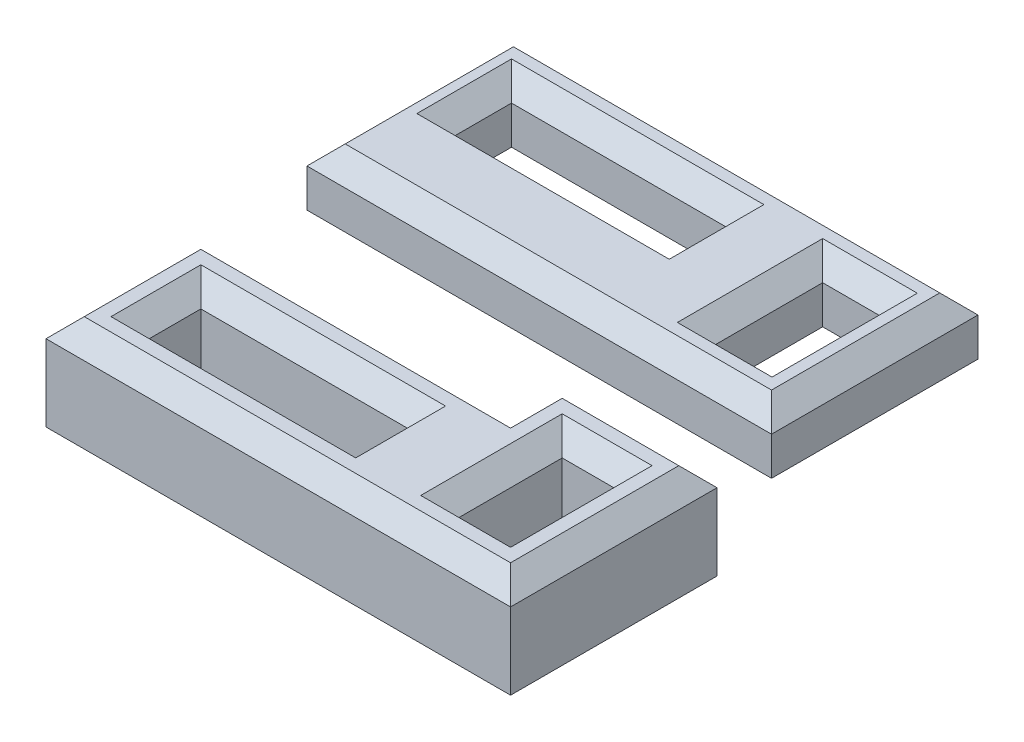
from build123d import *

# Parameters (mm, degrees)
BOSS_EXTRUDE1_DEPTH      = 2
BOSS_EXTRUDE1_DEPTH_BACK = 2
SKETCH1_W                = 2.7
SKETCH1_H                = 5.4
SKETCH1_W_2              = 10.8
SKETCH1_H_2              = 2.7
SKETCH2_W                = 1
SKETCH2_H                = 1
BOSS_EXTRUDE2_DEPTH      = 1
CHAMFER3_SIZE            = 1
SKETCH3_W                = 24.3
SKETCH3_H                = 10.8
SKETCH3_W_2              = 11.2
SKETCH3_H_2              = 2.95
SKETCH3_W_3              = 2.95
SKETCH3_H_3              = 5.6
BOSS_EXTRUDE3_DEPTH      = 3
CHAMFER4_SIZE            = 1


with BuildPart() as part:
    # Sketch1 → Boss-Extrude1 (new, two sides: drawn at the far end of the back side and taken through both)
    with BuildSketch(Plane(origin=(0, 0, 0), x_dir=(1, 0, 0), z_dir=(0, 1, 0)).offset(-BOSS_EXTRUDE1_DEPTH_BACK)):
        Polygon((-12.15, -5.4), (12.15, -5.4), (12.15, 5.4), (4.05, 5.4), (4.05, 2.7), (-12.15, 2.7), align=None)
        with Locations((8.1, 0)):
            Rectangle(SKETCH1_W, SKETCH1_H, mode=Mode.SUBTRACT)
        with Locations((-4.05, -1.35)):
            Rectangle(SKETCH1_W_2, SKETCH1_H_2, mode=Mode.SUBTRACT)
    extrude(amount=BOSS_EXTRUDE1_DEPTH + BOSS_EXTRUDE1_DEPTH_BACK)

    # Sketch2 → Boss-Extrude2 (add)
    with BuildSketch(Plane.XZ.offset(2)):
        Polygon((-12.15, 5.4), (12.15, 5.4), (12.15, -5.4), (4.05, -5.4), (4.05, -2.7), (-12.15, -2.7), align=None)
        with Locations((-8.1, 1.35)):
            Rectangle(SKETCH2_W, SKETCH2_H, mode=Mode.SUBTRACT)
        with Locations((-5.4, 1.35)):
            Rectangle(SKETCH2_W, SKETCH2_H, mode=Mode.SUBTRACT)
        with Locations((-2.7, 1.35)):
            Rectangle(SKETCH2_W, SKETCH2_H, mode=Mode.SUBTRACT)
        with Locations((0, 1.35)):
            Rectangle(SKETCH2_W, SKETCH2_H, mode=Mode.SUBTRACT)
        with Locations((8.1, 1.35)):
            Rectangle(SKETCH2_W, SKETCH2_H, mode=Mode.SUBTRACT)
        with Locations((8.1, -1.35)):
            Rectangle(SKETCH2_W, SKETCH2_H, mode=Mode.SUBTRACT)
    extrude(amount=BOSS_EXTRUDE2_DEPTH)

    # Chamfer3
    chamfer3_edges = [part.edges().sort_by_distance(p)[0] for p in [
        (0, 2, 5.4),
        (-4.05, 2, 2.7),
        (1.35, 2, 1.35),
        (-4.05, 2, 0),
        (-9.45, 2, 1.35),
        (-4.05, 2, -2.7),
        (4.05, 2, -4.05),
        (8.1, 2, -5.4),
        (12.15, 2, 0),
        (-12.15, 2, 1.35),
        (8.1, 2, 2.7),
        (9.45, 2, 0),
        (8.1, 2, -2.7),
        (6.75, 2, 0),
    ]]
    chamfer(chamfer3_edges, length=CHAMFER3_SIZE)


with BuildPart() as body_2:
    # Sketch3 → Boss-Extrude3 (new body)
    with BuildSketch(Plane(origin=(0, 0, 0), x_dir=(1, 0, 0), z_dir=(0, 1, 0))):
        with Locations((0, 13.65)):
            Rectangle(SKETCH3_W, SKETCH3_H)
        with Locations((-4.05, 14.975)):
            Rectangle(SKETCH3_W_2, SKETCH3_H_2, mode=Mode.SUBTRACT)
        with Locations((8.1, 13.65)):
            Rectangle(SKETCH3_W_3, SKETCH3_H_3, mode=Mode.SUBTRACT)
    extrude(amount=BOSS_EXTRUDE3_DEPTH)

    # Chamfer4
    chamfer4_edges = [body_2.edges().sort_by_distance(p)[0] for p in [
        (6.625, 3, -13.65),
        (8.1, 3, -10.85),
        (9.575, 3, -13.65),
        (8.1, 3, -16.45),
        (-9.65, 3, -14.975),
        (-4.05, 3, -13.5),
        (1.55, 3, -14.975),
        (-4.05, 3, -16.45),
        (0, 3, -8.25),
        (-12.15, 3, -13.65),
        (0, 3, -19.05),
        (12.15, 3, -13.65),
    ]]
    chamfer(chamfer4_edges, length=CHAMFER4_SIZE)


solid = Compound([part.part, body_2.part])
